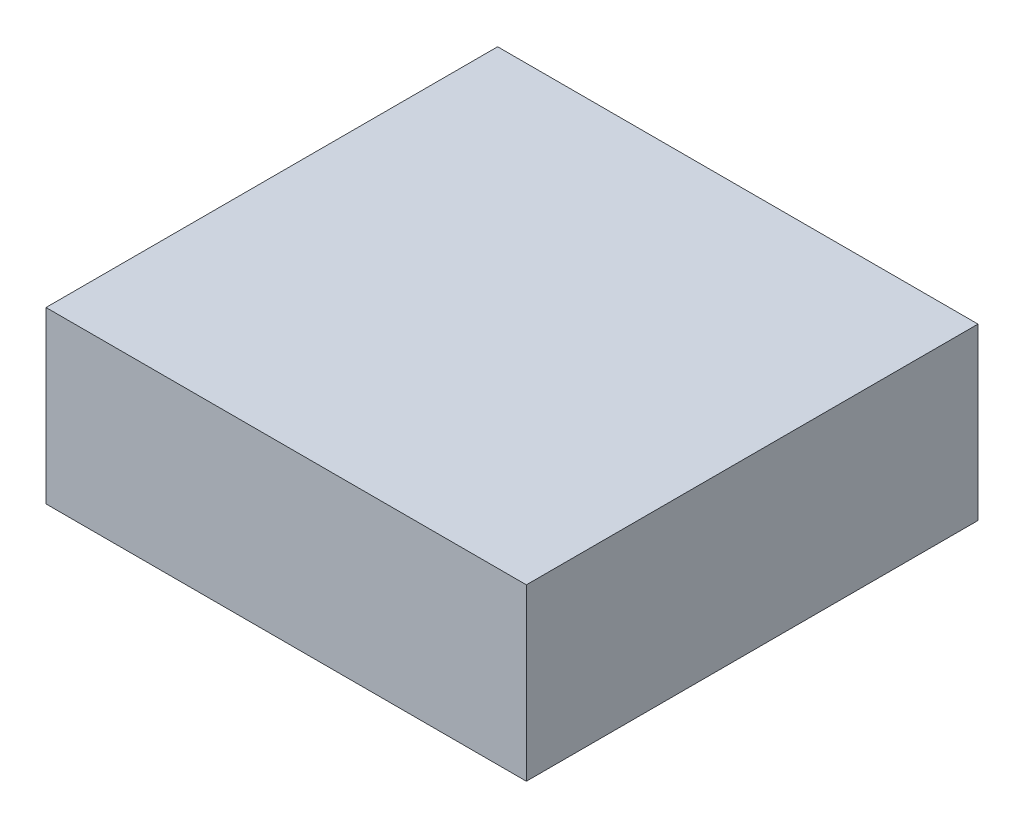
from build123d import *

# Parameters (mm, degrees)
SKETCH1_W           = 106.363185058
SKETCH1_H           = 37.668560522
BOSS_EXTRUDE1_DEPTH = 50


with BuildPart() as part:
    # Sketch1 → Boss-Extrude1 (new, symmetric)
    with BuildSketch(Plane.XY):
        Rectangle(SKETCH1_W, SKETCH1_H)
    extrude(amount=BOSS_EXTRUDE1_DEPTH, both=True)


solid = part.part
